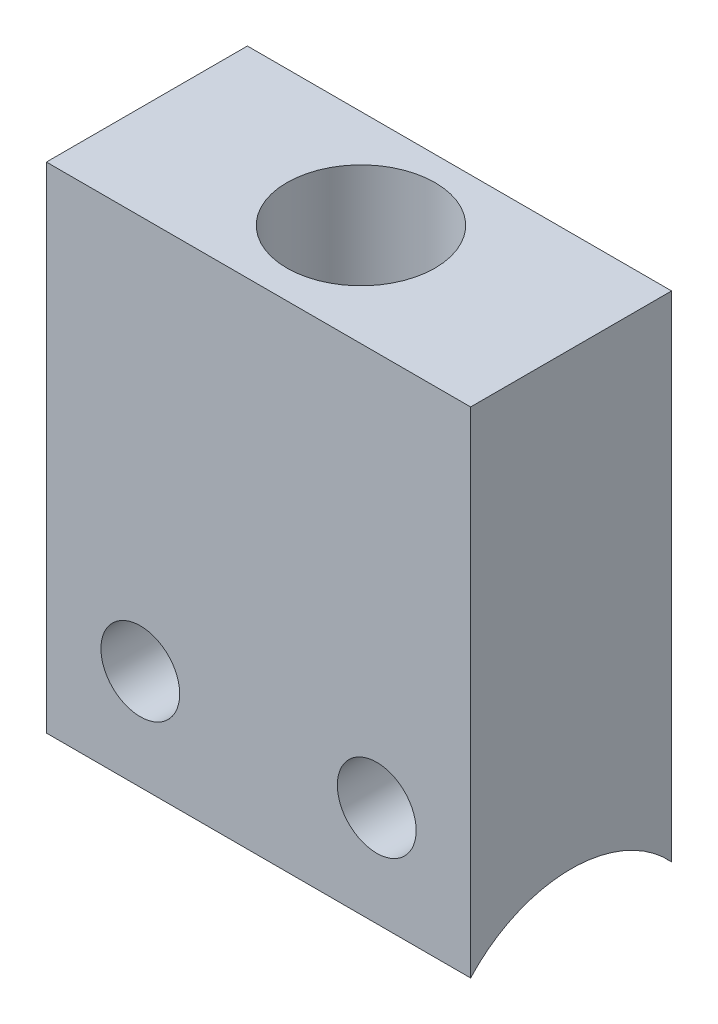
from build123d import *

# Parameters (mm, degrees)
SKETCH1_W           = 21.53
SKETCH1_H           = 30
BOSS_EXTRUDE1_DEPTH = 10.2
SKETCH2_R           = 3.76
CUT_EXTRUDE1_DEPTH  = 10
CUT_EXTRUDE2_REACH  = 30.153
SKETCH3_W           = 10.2
SKETCH3_H           = 4.899707594
CUT_EXTRUDE3_REACH  = 23.093
SKETCH4_R           = 2


with BuildPart() as part:
    # Sketch1 → Boss-Extrude1 (new body)
    with BuildSketch(Plane.XY):
        Rectangle(SKETCH1_W, SKETCH1_H)
    extrude(amount=BOSS_EXTRUDE1_DEPTH)

    # Sketch2 → Cut-Extrude1 (cut)
    with BuildSketch(Plane(origin=(0, 15, 0), x_dir=(1, 0, 0), z_dir=(0, 1, 0))):
        with Locations(Location((0, -5, 0), (0, 0, 270))):
            Circle(SKETCH2_R)
    extrude(amount=-CUT_EXTRUDE1_DEPTH, mode=Mode.SUBTRACT)

    # Sketch3 → Cut-Extrude2 (cut, up to next)
    with BuildSketch(Plane(origin=(10.765, 0, 0), x_dir=(0, 0, -1), z_dir=(1, 0, 0)), mode=Mode.PRIVATE) as cut_extrude2_sk1:
        with BuildLine():
            ThreePointArc((-10.2, -10.100292406), (-5.1, -7.850979668), (0, -10.100292406))
            Line((0, -10.100292406), (-10.2, -10.100292406))
        make_face()
    cut_extrude2_tool1 = extrude(cut_extrude2_sk1.sketch, amount=-CUT_EXTRUDE2_REACH, mode=Mode.PRIVATE) & part.part
    # Sketch3 → Cut-Extrude2 (cut, up to next)
    with BuildSketch(Plane(origin=(10.765, 0, 0), x_dir=(0, 0, -1), z_dir=(1, 0, 0)), mode=Mode.PRIVATE) as cut_extrude2_sk2:
        with Locations((-5.1, -12.550146203)):
            Rectangle(SKETCH3_W, SKETCH3_H)
    cut_extrude2_tool2 = extrude(cut_extrude2_sk2.sketch, amount=-CUT_EXTRUDE2_REACH, mode=Mode.PRIVATE) & part.part
    add(cut_extrude2_tool1.solids().sort_by_distance((10.765, -9.186693, 5.1))[0], mode=Mode.SUBTRACT)
    add(cut_extrude2_tool2.solids().sort_by_distance((10.765, -12.550146, 5.1))[0], mode=Mode.SUBTRACT)

    # Sketch4 → Cut-Extrude3 (cut, up to next)
    with BuildSketch(Plane.XY.offset(10.2), mode=Mode.PRIVATE) as cut_extrude3_sk1:
        with Locations((-6, -5)):
            Circle(SKETCH4_R)
    cut_extrude3_tool1 = extrude(cut_extrude3_sk1.sketch, amount=-CUT_EXTRUDE3_REACH, mode=Mode.PRIVATE) & part.part
    # Sketch4 → Cut-Extrude3 (cut, up to next)
    with BuildSketch(Plane.XY.offset(10.2), mode=Mode.PRIVATE) as cut_extrude3_sk2:
        with Locations((6, -5)):
            Circle(SKETCH4_R)
    cut_extrude3_tool2 = extrude(cut_extrude3_sk2.sketch, amount=-CUT_EXTRUDE3_REACH, mode=Mode.PRIVATE) & part.part
    add(cut_extrude3_tool1.solids().sort_by_distance((-6, -5, 10.2))[0], mode=Mode.SUBTRACT)
    add(cut_extrude3_tool2.solids().sort_by_distance((6, -5, 10.2))[0], mode=Mode.SUBTRACT)


solid = part.part
